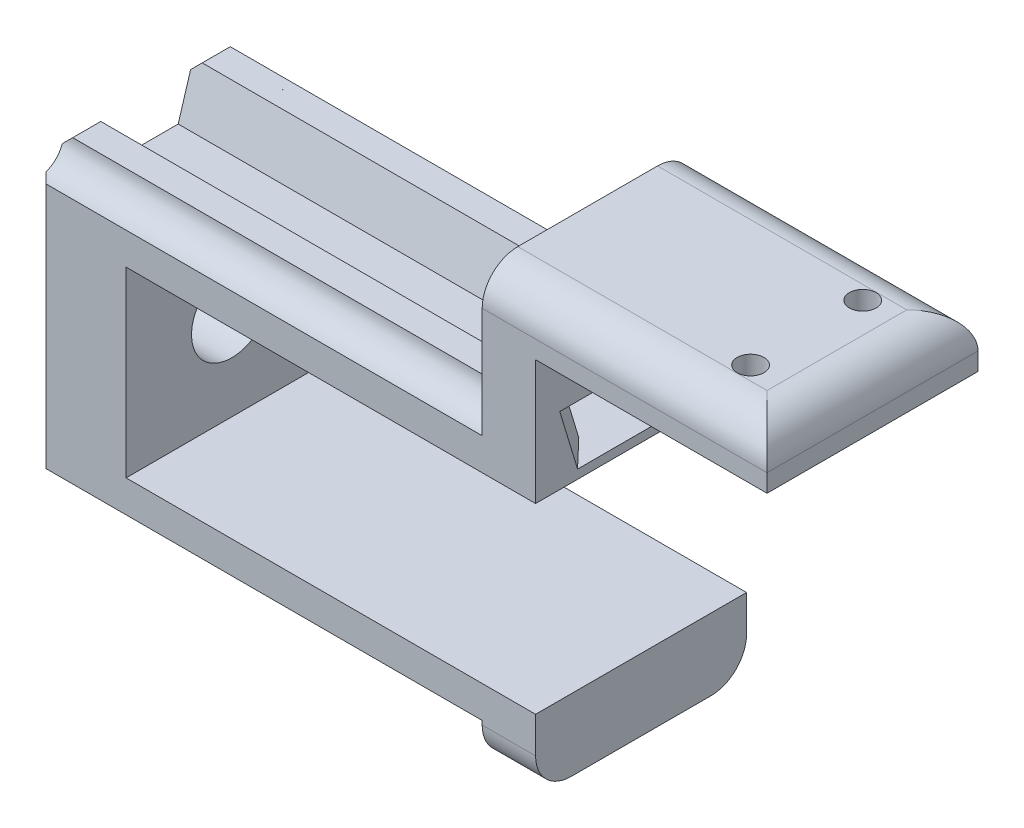
from build123d import *

# Parameters (mm, degrees)
BOSS_EXTRUDE1_DEPTH     = 25
CUT_EXTRUDE1_DEPTH      = 28.038606658
CUT_EXTRUDE1_DEPTH_BACK = 28.038606658
SKETCH2_W               = 20
SKETCH2_H               = 10.25
CUT_EXTRUDE2_DEPTH      = 23.496360817
CUT_EXTRUDE2_DEPTH_BACK = 23.496360817
SKETCH3_R               = 2.25
SKETCH5_W               = 11.85
SKETCH5_H               = 4.025
BOSS_EXTRUDE2_DEPTH     = 3
CUT_EXTRUDE3_DEPTH      = 33.370839501
CUT_EXTRUDE3_DEPTH_BACK = 33.370839501
SKETCH6_W               = 16
SKETCH6_H               = 11.85
SKETCH6_R               = 0.75
BOSS_EXTRUDE3_DEPTH     = 3
FILLET1_R               = 2
CHAMFER1_SIZE           = 1.5
CHAMFER2_SIZE           = 0.5


with BuildPart() as part:
    # Sketch1 → Boss-Extrude1 (new body)
    with BuildSketch(Plane(origin=(0, 0, 0), x_dir=(0, 0, -1), z_dir=(1, 0, 0))):
        with BuildLine():
            Line((-4.425, -8.425), (4.425, -8.425))
            ThreePointArc((4.425, -8.425), (4.864339828, -7.364339828), (5.925, -6.925))
            Line((5.925, -6.925), (5.925, 6.925))
            ThreePointArc((5.925, 6.925), (4.864339828, 7.364339828), (4.425, 8.425))
            Line((4.425, 8.425), (-4.425, 8.425))
            ThreePointArc((-4.425, 8.425), (-4.864339828, 7.364339828), (-5.925, 6.925))
            Line((-5.925, 6.925), (-5.925, -6.925))
            ThreePointArc((-5.925, -6.925), (-4.864339828, -7.364339828), (-4.425, -8.425))
        make_face()
    extrude(amount=BOSS_EXTRUDE1_DEPTH)

    # Sketch2 → Cut-Extrude1 (cut, two sides: drawn at the far end of the back side and taken through both)
    with BuildSketch(Plane.XY.offset(-CUT_EXTRUDE1_DEPTH_BACK)):
        with Locations((15, 0)):
            Rectangle(SKETCH2_W, SKETCH2_H)
    extrude(amount=CUT_EXTRUDE1_DEPTH + CUT_EXTRUDE1_DEPTH_BACK, mode=Mode.SUBTRACT)

    # Sketch3 → Cut-Extrude2 (cut, two sides: drawn at the far end of the back side and taken through both)
    with BuildSketch(Plane(origin=(5, 0, 0), x_dir=(0, 0, -1), z_dir=(1, 0, 0)).offset(-CUT_EXTRUDE2_DEPTH_BACK)):
        Circle(SKETCH3_R)
    extrude(amount=CUT_EXTRUDE2_DEPTH + CUT_EXTRUDE2_DEPTH_BACK, mode=Mode.SUBTRACT)

    # Sketch5 → Boss-Extrude2 (add)
    with BuildSketch(Plane(origin=(25, 0, 0), x_dir=(0, 0, -1), z_dir=(1, 0, 0))):
        Polygon((-5.925, 5.125), (5.925, 5.125), (5.925, 9.15), (5.925, 15.125), (-5.925, 15.125), (-5.925, 9.15), align=None)
        with Locations((0, -7.1375)):
            Rectangle(SKETCH5_W, SKETCH5_H)
    extrude(amount=BOSS_EXTRUDE2_DEPTH)

    # Sketch4 → Cut-Extrude3 (cut, two sides: drawn at the far end of the back side and taken through both)
    with BuildSketch(Plane(origin=(28, 0, 0), x_dir=(0, 0, -1), z_dir=(1, 0, 0)).offset(-CUT_EXTRUDE3_DEPTH_BACK)):
        Polygon((-3, 8.925), (3, 8.925), (2, 5.625), (-2, 5.625), align=None)
    extrude(amount=CUT_EXTRUDE3_DEPTH + CUT_EXTRUDE3_DEPTH_BACK, mode=Mode.SUBTRACT)

    # Sketch6 → Boss-Extrude3 (add)
    with BuildSketch(Plane.XZ.offset(-15.125)):
        with Locations((33, 0)):
            Rectangle(SKETCH6_W, SKETCH6_H)
        with Locations(Location((37.3, -3.15, 0), (0, 0, 270))):
            Circle(SKETCH6_R, mode=Mode.SUBTRACT)
        with Locations(Location((37.3, 3.15, 0), (0, 0, 270))):
            Circle(SKETCH6_R, mode=Mode.SUBTRACT)
    extrude(amount=BOSS_EXTRUDE3_DEPTH)

    # Fillet1
    fillet1_edges = [part.edges().sort_by_distance(p)[0] for p in [
        (41, 15.125, 0),
        (33, 15.125, -5.925),
        (33, 15.125, 5.925),
        (26.5, -9.15, 5.925),
        (26.5, -9.15, -5.925),
    ]]
    fillet(fillet1_edges, radius=FILLET1_R)

    # Chamfer1
    chamfer1_edges = [part.edges().sort_by_distance(p)[0] for p in [
        (28, 7.275, -2.5),
        (28, 7.275, 2.5),
    ]]
    chamfer(chamfer1_edges, length=CHAMFER1_SIZE)

    # Chamfer2
    chamfer2_edges = [part.edges().sort_by_distance(p)[0] for p in [
        (0, -8.425, 0),
        (0, 0, 5.925),
        (0, 8.425, 3.636742424),
        (0, 8.425, -3.636742424),
        (0, 0, -5.925),
    ]]
    chamfer(chamfer2_edges, length=CHAMFER2_SIZE)


solid = part.part
